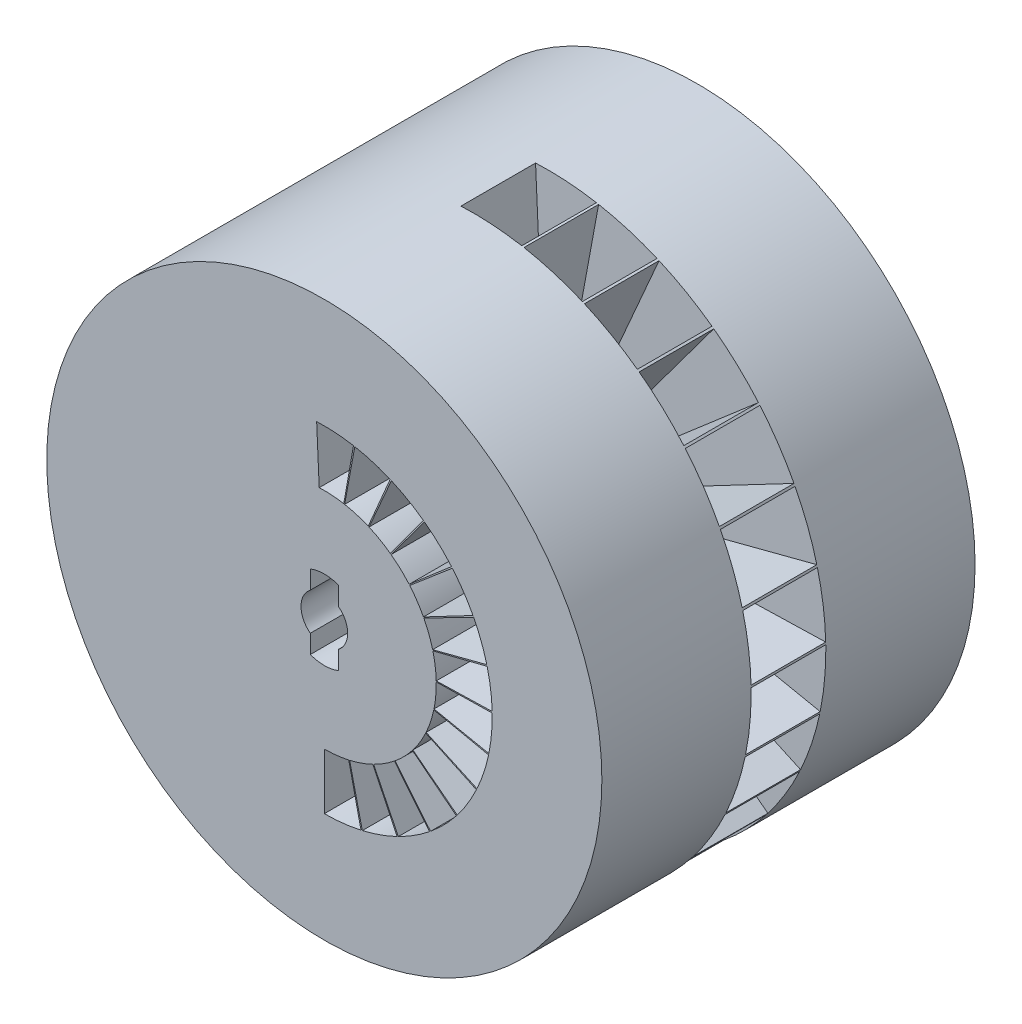
from build123d import *

# Parameters (mm, degrees)
SKETCH1_R               = 29.75
BOSS_EXTRUDE1_DEPTH     = 40
CUT_EXTRUDE1_DEPTH      = 4
CUT_EXTRUDE1_DEPTH_BACK = 4
CUT_EXTRUDE1_START      = -20
CUT_EXTRUDE3_START      = -16
CUT_EXTRUDE3_DEPTH      = 16


with BuildPart() as part:
    # Sketch1 → Boss-Extrude1 (new body)
    with BuildSketch(Plane.XY):
        Circle(SKETCH1_R)
        with BuildLine():
            Line((1.5, 2), (1.5, 3.97649343))
            ThreePointArc((1.5, 3.97649343), (0, 4.25), (-1.5, 3.97649343))
            Line((-1.5, 3.97649343), (-1.5, 2))
            ThreePointArc((-1.5, 2), (-2.5, 0), (-1.5, -2))
            Line((-1.5, -2), (-1.5, -3.97649343))
            ThreePointArc((-1.5, -3.97649343), (0, -4.25), (1.5, -3.97649343))
            Line((1.5, -3.97649343), (1.5, -2))
            ThreePointArc((1.5, -2), (2.5, 0), (1.5, 2))
        make_face(mode=Mode.SUBTRACT)
    extrude(amount=BOSS_EXTRUDE1_DEPTH)

    # Sketch2 → Cut-Extrude1 (cut, two sides: drawn at the far end of the back side and taken through both)
    with BuildSketch(Plane.XY.offset(40).offset(CUT_EXTRUDE1_START - CUT_EXTRUDE1_DEPTH_BACK)):
        with BuildLine():
            Line((2.621054601, -11.710255026), (6.498031199, -29.031673919))
            ThreePointArc((6.498031199, -29.031673919), (3.268807192, -29.569873174), (0, -29.75))
            Line((0, -29.75), (0, -12))
            ThreePointArc((0, -12), (1.318510464, -11.927343801), (2.621054601, -11.710255026))
        make_face()
        with BuildLine():
            Line((5.202633875, -10.813537847), (12.898196481, -26.808562579))
            ThreePointArc((12.898196481, -26.808562579), (9.874487797, -28.06344581), (6.731205322, -28.978498493))
            Line((6.731205322, -28.978498493), (2.715108029, -11.688806115))
            ThreePointArc((2.715108029, -11.688806115), (3.982986674, -11.319709234), (5.202633875, -10.813537847))
        make_face()
        with BuildLine():
            Line((7.514375173, -9.355969525), (18.62938845, -23.195007781))
            ThreePointArc((18.62938845, -23.195007781), (15.968021699, -25.101489657), (13.113292322, -26.704008397))
            Line((13.113292322, -26.704008397), (5.289395222, -10.771364732))
            ThreePointArc((5.289395222, -10.771364732), (6.440882702, -10.124970618), (7.514375173, -9.355969525))
        make_face()
        with BuildLine():
            Line((9.436378538, -7.413147786), (23.394355125, -18.378428885))
            ThreePointArc((23.394355125, -18.378428885), (21.233363816, -20.837628489), (18.815249924, -23.044497614))
            Line((18.815249924, -23.044497614), (7.589344507, -9.295259542))
            ThreePointArc((7.589344507, -9.295259542), (8.564718178, -8.405093844), (9.436378538, -7.413147786))
        make_face()
        with BuildLine():
            Line((10.868958019, -5.085838336), (26.945958422, -12.608640875))
            ThreePointArc((26.945958422, -12.608640875), (25.397423769, -15.493010227), (23.541342405, -18.189769041))
            Line((23.541342405, -18.189769041), (9.495667525, -7.337049697))
            ThreePointArc((9.495667525, -7.337049697), (10.244338999, -6.249281436), (10.868958019, -5.085838336))
        make_face()
        with BuildLine():
            Line((11.737811955, -2.494748588), (29.099992138, -6.184897541))
            ThreePointArc((29.099992138, -6.184897541), (28.244229893, -9.344836957), (27.046447919, -12.391616317))
            Line((27.046447919, -12.391616317), (10.909491598, -4.998299019))
            ThreePointArc((10.909491598, -4.998299019), (11.392630545, -3.769345999), (11.737811955, -2.494748588))
        make_face()
        with BuildLine():
            Line((11.997876673, 0.225732911), (29.744735918, 0.559629508))
            ThreePointArc((29.744735918, 0.559629508), (29.626130745, -2.711987667), (29.148771898, -5.95076439))
            Line((29.148771898, -5.95076439), (11.757487825, -2.400308325))
            ThreePointArc((11.757487825, -2.400308325), (11.950035931, -1.093910992), (11.997876673, 0.225732911))
        make_face()
        with BuildLine():
            Line((11.635663748, 2.934506626), (28.846749709, 7.275131011))
            ThreePointArc((28.846749709, 7.275131011), (29.471453141, 4.061520619), (29.739275948, 0.798727786))
            Line((29.739275948, 0.798727786), (11.995674332, 0.322175914))
            ThreePointArc((11.995674332, 0.322175914), (11.887644965, 1.638260418), (11.635663748, 2.934506626))
        make_face()
        with BuildLine():
            Line((10.669959589, 5.491080255), (26.452608147, 13.613303133))
            ThreePointArc((26.452608147, 13.613303133), (27.788219537, 10.624375509), (28.787333194, 7.506793428))
            Line((28.787333194, 7.506793428), (11.611697423, 3.02795029))
            ThreePointArc((11.611697423, 3.02795029), (11.208693595, 4.28546239), (10.669959589, 5.491080255))
        make_face()
        with BuildLine():
            Line((9.150851066, 7.762855451), (22.686484935, 19.245412473))
            ThreePointArc((22.686484935, 19.245412473), (24.663731933, 16.636190283), (26.342316763, 13.825514368))
            Line((26.342316763, 13.825514368), (10.625472308, 5.576678065))
            ThreePointArc((10.625472308, 5.576678065), (9.948396074, 6.710396081), (9.150851066, 7.762855451))
        make_face()
        with BuildLine():
            Line((7.157127728, 9.632005123), (17.743712492, 23.879346034))
            ThreePointArc((17.743712492, 23.879346034), (20.260043902, 21.785158276), (22.531039016, 19.427166053))
            Line((22.531039016, 19.427166053), (9.088150191, 7.83616782))
            ThreePointArc((9.088150191, 7.83616782), (8.172118549, 8.787290733), (7.157127728, 9.632005123))
        make_face()
        with BuildLine():
            Line((4.792195325, 11.001584611), (11.880650911, 27.274761849))
            ThreePointArc((11.880650911, 27.274761849), (14.805555575, 25.804224928), (17.551174341, 24.021215191))
            Line((17.551174341, 24.021215191), (7.07946528, 9.689229657))
            ThreePointArc((7.07946528, 9.689229657), (5.971988803, 10.408426862), (4.792195325, 11.001584611))
        make_face()
        with BuildLine():
            Line((2.178712609, 11.80055979), (5.401391677, 29.25555448))
            ThreePointArc((5.401391677, 29.25555448), (8.583167521, 28.484938745), (11.661006643, 27.369388449))
            Line((11.661006643, 27.369388449), (4.703599318, 11.039753324))
            ThreePointArc((4.703599318, 11.039753324), (3.462117992, 11.489723191), (2.178712609, 11.80055979))
        make_face()
        with BuildLine():
            Line((-0.547770447, 11.987491295), (-1.358014233, 29.718988834))
            ThreePointArc((-1.358014233, 29.718988834), (1.915607925, 29.68826277), (5.166033286, 29.298030652))
            Line((5.166033286, 29.298030652), (2.083778132, 11.817693036))
            ThreePointArc((2.083778132, 11.817693036), (0.772682188, 11.975097588), (-0.547770447, 11.987491295))
        make_face()
    extrude(amount=CUT_EXTRUDE1_DEPTH + CUT_EXTRUDE1_DEPTH_BACK, mode=Mode.SUBTRACT)

    # Sketch3 → Cut-Extrude3 (cut)
    with BuildSketch(Plane.XY.offset(40).offset(CUT_EXTRUDE3_START)):
        with BuildLine():
            Line((0, -12), (0, -18))
            ThreePointArc((0, -18), (1.977765696, -17.891015702), (3.931581902, -17.565382539))
            Line((3.931581902, -17.565382539), (2.621054601, -11.710255026))
            ThreePointArc((2.621054601, -11.710255026), (1.318510464, -11.927343801), (0, -12))
        make_face()
        with BuildLine():
            Line((2.715108029, -11.688806115), (4.072662044, -17.533209172))
            ThreePointArc((4.072662044, -17.533209172), (5.974480012, -16.979563852), (7.803950812, -16.22030677))
            Line((7.803950812, -16.22030677), (5.202633875, -10.813537847))
            ThreePointArc((5.202633875, -10.813537847), (3.982986674, -11.319709234), (2.715108029, -11.688806115))
        make_face()
        with BuildLine():
            Line((5.289395222, -10.771364732), (7.934092833, -16.157047098))
            ThreePointArc((7.934092833, -16.157047098), (9.661324053, -15.187455927), (11.27156276, -14.033954288))
            Line((11.27156276, -14.033954288), (7.514375173, -9.355969525))
            ThreePointArc((7.514375173, -9.355969525), (6.440882702, -10.124970618), (5.289395222, -10.771364732))
        make_face()
        with BuildLine():
            Line((7.589344507, -9.295259542), (11.384016761, -13.942889313))
            ThreePointArc((11.384016761, -13.942889313), (12.847077267, -12.607640767), (14.154567807, -11.119721679))
            Line((14.154567807, -11.119721679), (9.436378538, -7.413147786))
            ThreePointArc((9.436378538, -7.413147786), (8.564718178, -8.405093844), (7.589344507, -9.295259542))
        make_face()
        with BuildLine():
            Line((9.495667525, -7.337049697), (14.243501287, -11.005574546))
            ThreePointArc((14.243501287, -11.005574546), (15.366508499, -9.373922154), (16.303437028, -7.628757504))
            Line((16.303437028, -7.628757504), (10.868958019, -5.085838336))
            ThreePointArc((10.868958019, -5.085838336), (10.244338999, -6.249281436), (9.495667525, -7.337049697))
        make_face()
        with BuildLine():
            Line((10.909491598, -4.998299019), (16.364237396, -7.497448528))
            ThreePointArc((16.364237396, -7.497448528), (17.088945818, -5.654018999), (17.606717932, -3.742122882))
            Line((17.606717932, -3.742122882), (11.737811955, -2.494748588))
            ThreePointArc((11.737811955, -2.494748588), (11.392630545, -3.769345999), (10.909491598, -4.998299019))
        make_face()
        with BuildLine():
            Line((11.757487825, -2.400308325), (17.636231737, -3.600462488))
            ThreePointArc((17.636231737, -3.600462488), (17.925053896, -1.640866488), (17.996815009, 0.338599366))
            Line((17.996815009, 0.338599366), (11.997876673, 0.225732911))
            ThreePointArc((11.997876673, 0.225732911), (11.950035931, -1.093910992), (11.757487825, -2.400308325))
        make_face()
        with BuildLine():
            Line((11.995674332, 0.322175914), (17.993511498, 0.483263871))
            ThreePointArc((17.993511498, 0.483263871), (17.831467447, 2.457390627), (17.453495622, 4.40175994))
            Line((17.453495622, 4.40175994), (11.635663748, 2.934506626))
            ThreePointArc((11.635663748, 2.934506626), (11.887644965, 1.638260418), (11.995674332, 0.322175914))
        make_face()
        with BuildLine():
            Line((11.611697423, 3.02795029), (17.417546134, 4.541925436))
            ThreePointArc((17.417546134, 4.541925436), (16.813040392, 6.428193585), (16.004939383, 8.236620383))
            Line((16.004939383, 8.236620383), (10.669959589, 5.491080255))
            ThreePointArc((10.669959589, 5.491080255), (11.208693595, 4.28546239), (11.611697423, 3.02795029))
        make_face()
        with BuildLine():
            Line((10.625472308, 5.576678065), (15.938208462, 8.365017097))
            ThreePointArc((15.938208462, 8.365017097), (14.922594111, 10.065594121), (13.7262766, 11.644283177))
            Line((13.7262766, 11.644283177), (9.150851066, 7.762855451))
            ThreePointArc((9.150851066, 7.762855451), (9.948396074, 6.710396081), (10.625472308, 5.576678065))
        make_face()
        with BuildLine():
            Line((9.088150191, 7.83616782), (13.632225287, 11.75425173))
            ThreePointArc((13.632225287, 11.75425173), (12.258177823, 13.1809361), (10.735691592, 14.448007684))
            Line((10.735691592, 14.448007684), (7.157127728, 9.632005123))
            ThreePointArc((7.157127728, 9.632005123), (8.172118549, 8.787290733), (9.088150191, 7.83616782))
        make_face()
        with BuildLine():
            Line((7.07946528, 9.689229657), (10.61919792, 14.533844485))
            ThreePointArc((10.61919792, 14.533844485), (8.957983205, 15.612640292), (7.188292988, 16.502376917))
            Line((7.188292988, 16.502376917), (4.792195325, 11.001584611))
            ThreePointArc((4.792195325, 11.001584611), (5.971988803, 10.408426862), (7.07946528, 9.689229657))
        make_face()
        with BuildLine():
            Line((4.703599318, 11.039753324), (7.055398977, 16.559629986))
            ThreePointArc((7.055398977, 16.559629986), (5.193176987, 17.234584787), (3.268068914, 17.700839686))
            Line((3.268068914, 17.700839686), (2.178712609, 11.80055979))
            ThreePointArc((2.178712609, 11.80055979), (3.462117992, 11.489723191), (4.703599318, 11.039753324))
        make_face()
        with BuildLine():
            Line((2.083778132, 11.817693036), (3.125667198, 17.726539554))
            ThreePointArc((3.125667198, 17.726539554), (1.159023282, 17.962646382), (-0.821655671, 17.981236942))
            Line((-0.821655671, 17.981236942), (-0.547770447, 11.987491295))
            ThreePointArc((-0.547770447, 11.987491295), (0.772682188, 11.975097588), (2.083778132, 11.817693036))
        make_face()
    extrude(amount=CUT_EXTRUDE3_DEPTH, mode=Mode.SUBTRACT)


solid = part.part
